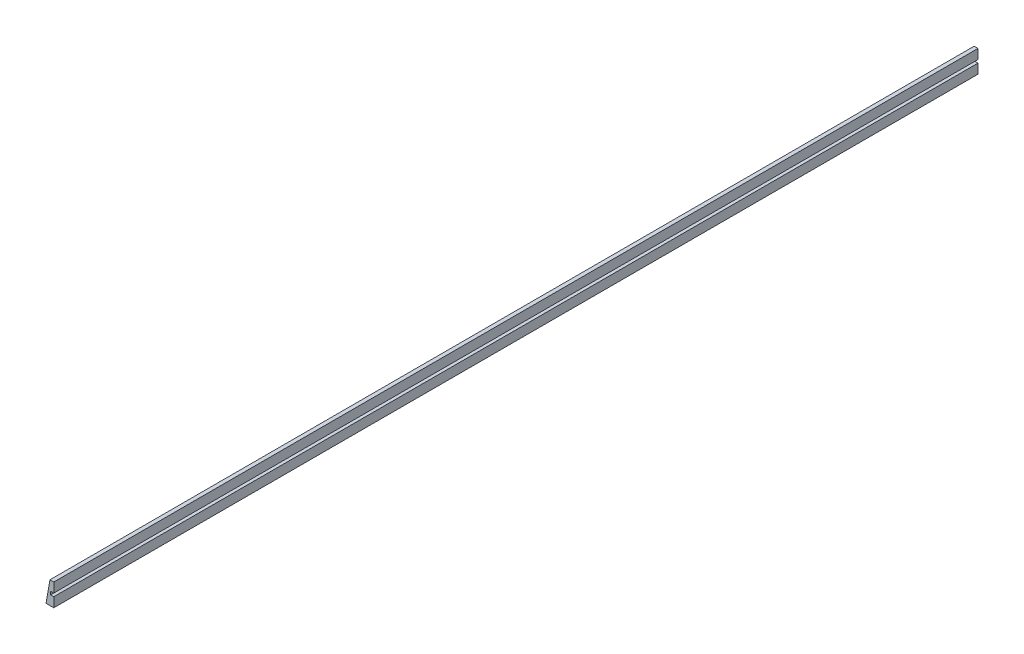
from build123d import *

# Parameters (mm, degrees)
BOSS_EXTRUDE1_DEPTH = 762
BOSS_EXTRUDE2_START = -762
BOSS_EXTRUDE2_DEPTH = 1524


with BuildPart() as part:
    # Sketch1 → Boss-Extrude1 (new, symmetric)
    with BuildSketch(Plane.XY):
        Polygon((3.175, 2.54), (-1.905, 2.54), (-1.905, -2.54), (3.175, -2.54), (3.175, -18.415), (-3.175, -18.415), (-3.175, 18.415), (3.175, 18.415), align=None)
    extrude(amount=BOSS_EXTRUDE1_DEPTH, both=True)

    # Sketch2 → Boss-Extrude2 (add)
    with BuildSketch(Plane.XY.offset(BOSS_EXTRUDE2_START)):
        Polygon((-3.175, 18.415), (-3.175, -18.415), (-9.669122699, -18.415), align=None)
    extrude(amount=BOSS_EXTRUDE2_DEPTH)


solid = part.part
